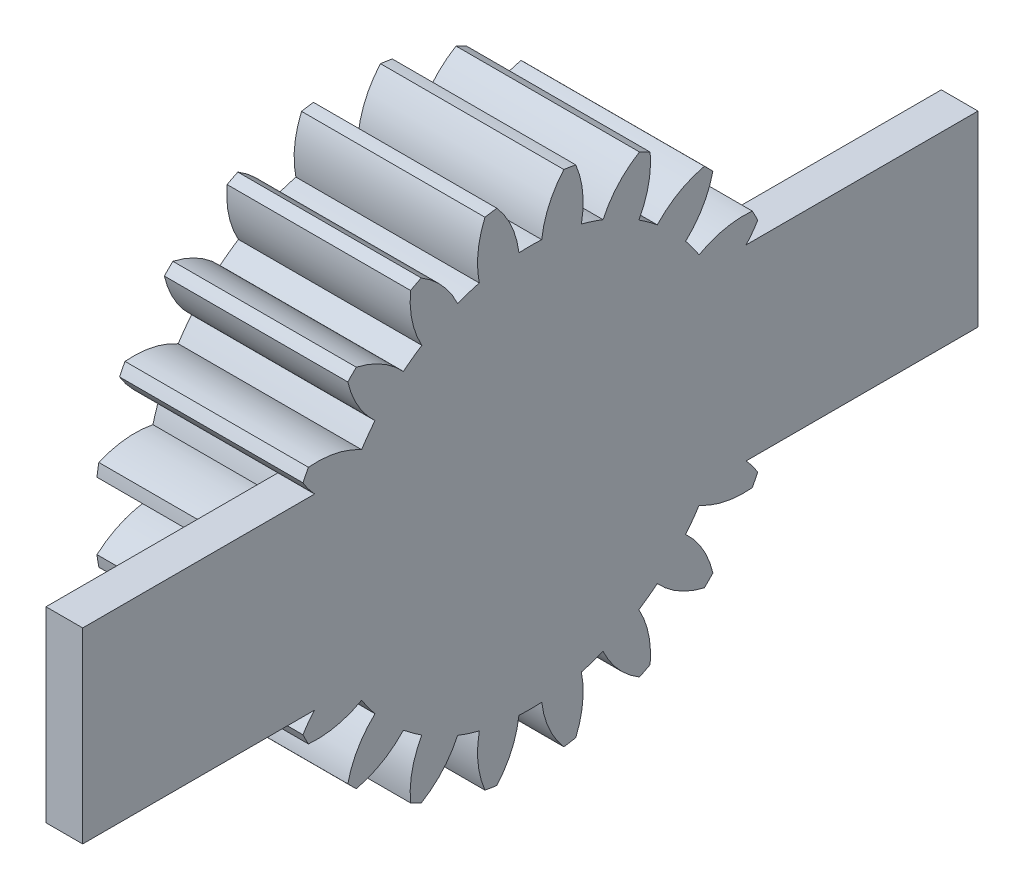
from build123d import *

# Parameters (mm, degrees)
BASPROSKE_W         = 12.7
BASPROSKE_H         = 17.4625
TOOTHCUT_DEPTH      = 28.769908399
TEETHCUTS_COUNT     = 20
TEETHCUTS_ANGLE     = 342
BORSKE_R            = 2.38125
BORE_DEPTH          = 50.8000508
SKETCH1_W           = 61.991981732
SKETCH1_H           = 12.955644482
BOSS_EXTRUDE1_DEPTH = 2.54


with BuildPart() as part:
    # BasProSke → Base-Revolve (revolve)
    with BuildSketch(Plane(origin=(0, 0, 0), x_dir=(1, 0, 0), z_dir=(0, 1, 0)), mode=Mode.PRIVATE) as base_revolve_sk:
        with Locations((6.35, 8.73125)):
            Rectangle(BASPROSKE_W, BASPROSKE_H)
    revolve(base_revolve_sk.sketch.rotate(Axis((-10, 0, 0), (1, 0, 0)), 180), axis=Axis((-10, 0, 0), (1, 0, 0)))

    # TooCutSke → ToothCut (cut, through all)
    with BuildSketch(Plane(origin=(0, 0, 0), x_dir=(0, 0, -1), z_dir=(1, 0, 0))):
        with BuildLine():
            ThreePointArc((0.788800759, 13.866938223), (0, 13.889355), (-0.788800759, 13.866938223))
            ThreePointArc((-0.788800759, 13.866938223), (-1.299448137, 15.717380814), (-2.339725589, 17.330675999))
            ThreePointArc((-2.339725589, 17.330675999), (0, 17.4879), (2.339725589, 17.330675999))
            ThreePointArc((2.339725589, 17.330675999), (1.299448137, 15.717380814), (0.788800759, 13.866938223))
        make_face()
    toothcut = extrude(amount=TOOTHCUT_DEPTH, mode=Mode.SUBTRACT)

    # TeethCuts: ToothCut ×20 about axis
    teethcuts_axis = Axis((-10, 0, 0), (1, 0, 0))
    for i in range(1, TEETHCUTS_COUNT):
        add(toothcut.rotate(teethcuts_axis, i * TEETHCUTS_ANGLE / (TEETHCUTS_COUNT - 1)), mode=Mode.SUBTRACT)

    # BorSke → Bore (cut, symmetric)
    with BuildSketch(Plane(origin=(0, 0, 0), x_dir=(0, 0, -1), z_dir=(1, 0, 0))):
        with Locations(Location((0, 0, 0), (0, 0, 180))):
            Circle(BORSKE_R)
    extrude(amount=BORE_DEPTH, both=True, mode=Mode.SUBTRACT)

    # Sketch1 → Boss-Extrude1 (add)
    with BuildSketch(Plane(origin=(12.7, 0, 0), x_dir=(0, 0, -1), z_dir=(1, 0, 0))):
        Rectangle(SKETCH1_W, SKETCH1_H)
    extrude(amount=-BOSS_EXTRUDE1_DEPTH)


solid = part.part
